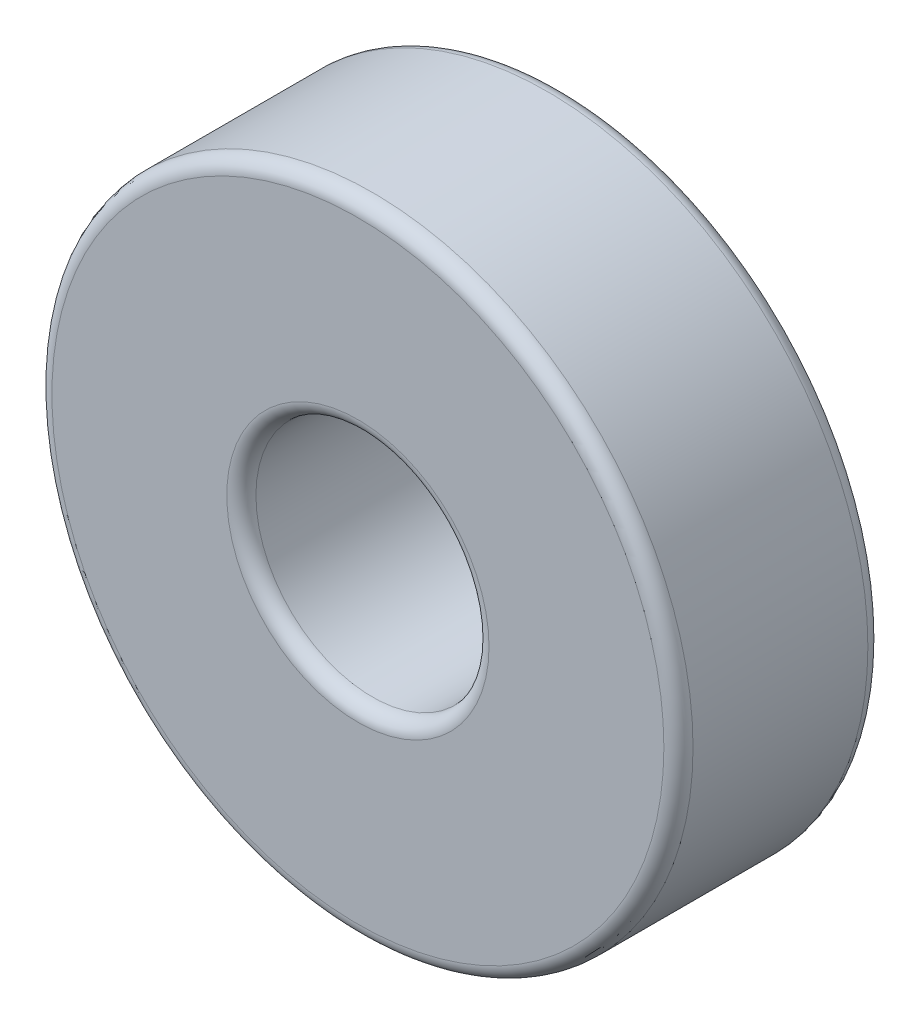
from build123d import *

# Parameters (mm, degrees)
SKETCH_1_R      = 11
SKETCH_1_R_2    = 4
EXTRUDE_1_DEPTH = 7
FILLET_1_R      = 0.5


with BuildPart() as part:
    # Эскиз1 → Бобышка-Вытянуть1 (new body)
    with BuildSketch(Plane.XY):
        Circle(SKETCH_1_R)
        Circle(SKETCH_1_R_2, mode=Mode.SUBTRACT)
    extrude(amount=EXTRUDE_1_DEPTH)

    # Скругление1
    fillet_1_edges = [part.edges().sort_by_distance(p)[0] for p in [
        (-11, 0, 0),
        (-11, 0, 7),
        (-4, 0, 0),
        (-4, 0, 7),
    ]]
    fillet(fillet_1_edges, radius=FILLET_1_R)


solid = part.part
